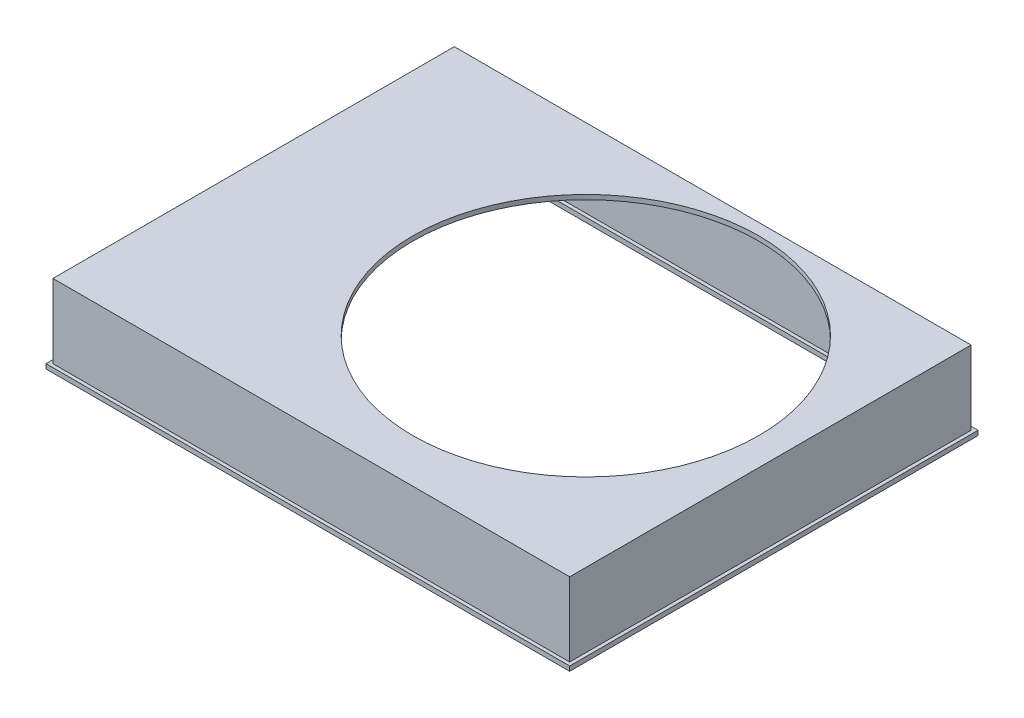
from build123d import *

# Parameters (mm, degrees)
SKETCH_1_W      = 224
SKETCH_1_H      = 174
SKETCH_1_W_2    = 220
SKETCH_1_H_2    = 170
EXTRUDE_1_DEPTH = 32
SKETCH_2_W      = 227
SKETCH_2_H      = 177
SKETCH_2_W_2    = 217
SKETCH_2_H_2    = 167
EXTRUDE_2_DEPTH = 2
SKETCH_3_W      = 222
SKETCH_3_H      = 172
SKETCH_3_R      = 75
EXTRUDE_3_DEPTH = 2


with BuildPart() as part:
    # 草图1 → 凸台-拉伸1 (new body)
    with BuildSketch(Plane(origin=(0, 0, 0), x_dir=(1, 0, 0), z_dir=(0, 1, 0))):
        with Locations((110, -85)):
            Rectangle(SKETCH_1_W, SKETCH_1_H)
        with Locations((110, -85)):
            Rectangle(SKETCH_1_W_2, SKETCH_1_H_2, mode=Mode.SUBTRACT)
    extrude(amount=EXTRUDE_1_DEPTH)

    # 草图2 → 凸台-拉伸2 (add)
    with BuildSketch(Plane(origin=(0, 0, 0), x_dir=(1, 0, 0), z_dir=(0, 1, 0))):
        with Locations((110, -85)):
            Rectangle(SKETCH_2_W, SKETCH_2_H)
        with Locations((110, -85)):
            Rectangle(SKETCH_2_W_2, SKETCH_2_H_2, mode=Mode.SUBTRACT)
    extrude(amount=-EXTRUDE_2_DEPTH)

    # 草图3 → 凸台-拉伸3 (add)
    with BuildSketch(Plane(origin=(0, 32, 0), x_dir=(1, 0, 0), z_dir=(0, 1, 0))):
        with Locations((109, -84)):
            Rectangle(SKETCH_3_W, SKETCH_3_H)
        with Locations(Location((135, -78, 0), (0, 0, 270))):
            Circle(SKETCH_3_R, mode=Mode.SUBTRACT)
    extrude(amount=-EXTRUDE_3_DEPTH)


solid = part.part
